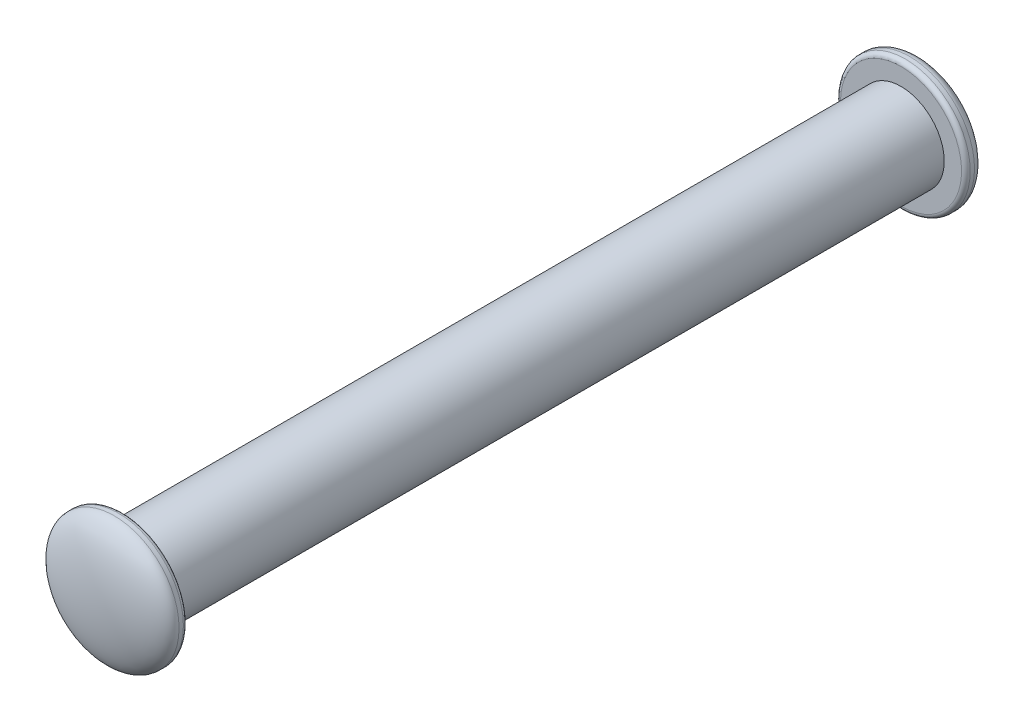
from build123d import *

# Parameters (mm, degrees)
SKETCH1_R                  = 0.5
BOSS_EXTRUDE1_DEPTH        = 4.5
SKETCH2_R                  = 0.75
BOSS_EXTRUDE2_DEPTH        = 0.1
DOME1_FACE_RADIUS          = 0.75
DOME1_HEIGHT               = 0.25
FILLET1_R                  = 0.05
MIRROR2_COPY_1_FACE_RADIUS = 0.75
MIRROR2_COPY_1_HEIGHT      = 0.25
FILLET1_OF_MIRROR2_R       = 0.05


with BuildPart() as part:
    # Sketch1 → Boss-Extrude1 (new, symmetric)
    with BuildSketch(Plane.XY):
        Circle(SKETCH1_R)
    extrude(amount=BOSS_EXTRUDE1_DEPTH, both=True)

    # Sketch2 → Boss-Extrude2 (add)
    with BuildSketch(Plane.XY.offset(4.5)):
        Circle(SKETCH2_R)
    boss_extrude2 = extrude(amount=BOSS_EXTRUDE2_DEPTH)

    # Dome1: an elliptical dome of height H over a round flat face of radius A is half a spheroid: the quarter ellipse of half axes A and H revolved about the face's axis
    with BuildSketch(Plane((0, 0, 4.6), x_dir=(0, 1, 0), z_dir=(1, 0, 0)), mode=Mode.PRIVATE) as dome1_quarter:
        Ellipse(DOME1_FACE_RADIUS, DOME1_HEIGHT)
        Rectangle(DOME1_FACE_RADIUS, DOME1_HEIGHT, align=(Align.MIN, Align.MIN), mode=Mode.INTERSECT)
    revolve(dome1_quarter.sketch, axis=Axis((0, 0, 4.6), (0, 0, 1)))

    # Fillet1
    fillet1_edges = [part.edges().sort_by_distance(p)[0] for p in [
        (-0.75, 0, 4.5),
    ]]
    fillet(fillet1_edges, radius=FILLET1_R)

    # Mirror2: Boss-Extrude2 across plane
    add(boss_extrude2.mirror(Plane.XY))

    # Mirror2 copy 1: an elliptical dome of height H over a round flat face of radius A is half a spheroid: the quarter ellipse of half axes A and H revolved about the face's axis
    with BuildSketch(Plane((0, 0, -4.6), x_dir=(0, -1, 0), z_dir=(1, 0, 0)), mode=Mode.PRIVATE) as mirror2_copy_1_quarter:
        Ellipse(MIRROR2_COPY_1_FACE_RADIUS, MIRROR2_COPY_1_HEIGHT)
        Rectangle(MIRROR2_COPY_1_FACE_RADIUS, MIRROR2_COPY_1_HEIGHT, align=(Align.MIN, Align.MIN), mode=Mode.INTERSECT)
    revolve(mirror2_copy_1_quarter.sketch, axis=Axis((0, 0, -4.6), (0, 0, -1)))

    # Fillet1 of Mirror2
    fillet1_of_mirror2_edges = [part.edges().sort_by_distance(p)[0] for p in [
        (-0.75, 0, -4.5),
    ]]
    fillet(fillet1_of_mirror2_edges, radius=FILLET1_OF_MIRROR2_R)


solid = part.part
